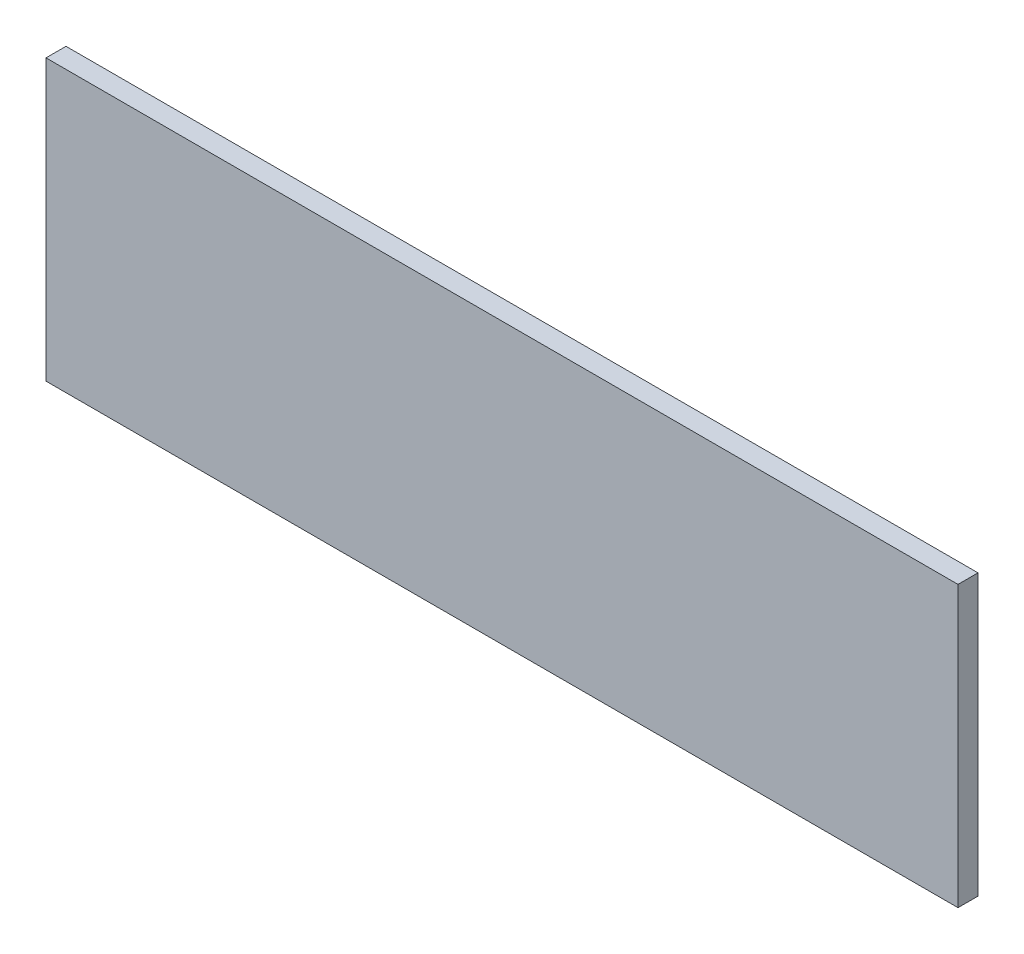
from build123d import *

# Parameters (mm, degrees)
SKETCH_1_W      = 228
SKETCH_1_H      = 70
EXTRUDE_1_DEPTH = 5


with BuildPart() as part:
    # 草图1 → 凸台-拉伸1 (new body)
    with BuildSketch(Plane.XY):
        Rectangle(SKETCH_1_W, SKETCH_1_H)
    extrude(amount=EXTRUDE_1_DEPTH)


solid = part.part
